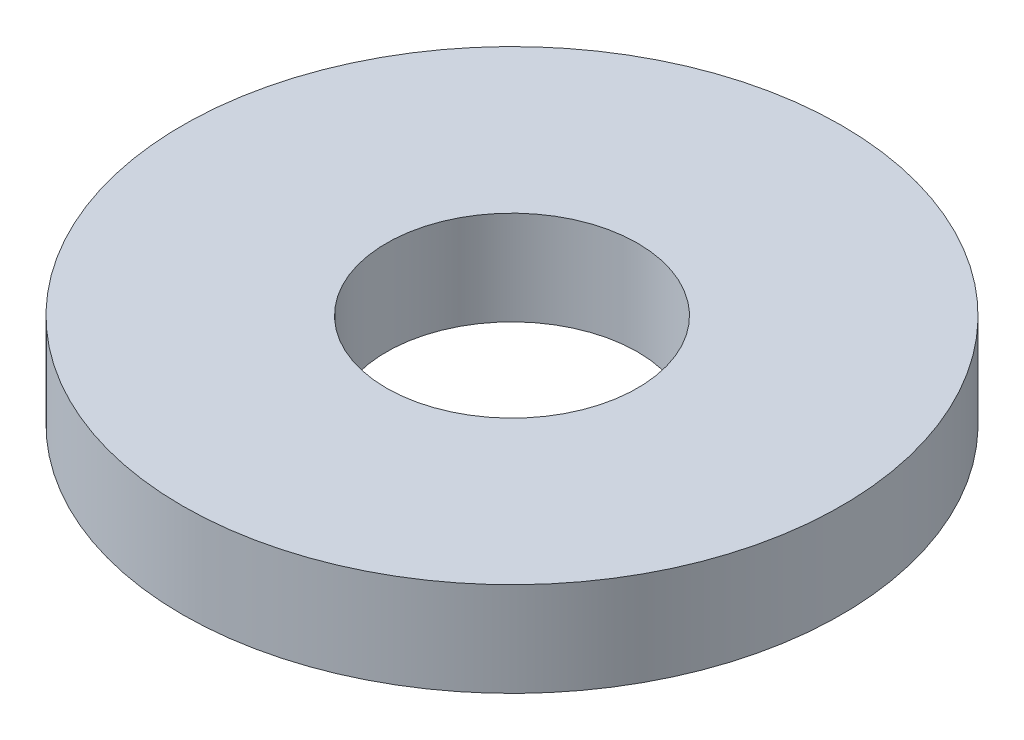
from build123d import *

# Parameters (mm, degrees)
SKETCH1_R           = 42
SKETCH1_R_2         = 16
BOSS_EXTRUDE1_DEPTH = 6


with BuildPart() as part:
    # Sketch1 → Boss-Extrude1 (new, symmetric)
    with BuildSketch(Plane(origin=(0, 0, 0), x_dir=(1, 0, 0), z_dir=(0, 1, 0))):
        with Locations(Location((0, 0, 0), (0, 0, 270))):
            Circle(SKETCH1_R)
        with Locations(Location((0, 0, 0), (0, 0, 270))):
            Circle(SKETCH1_R_2, mode=Mode.SUBTRACT)
    extrude(amount=BOSS_EXTRUDE1_DEPTH, both=True)


solid = part.part
